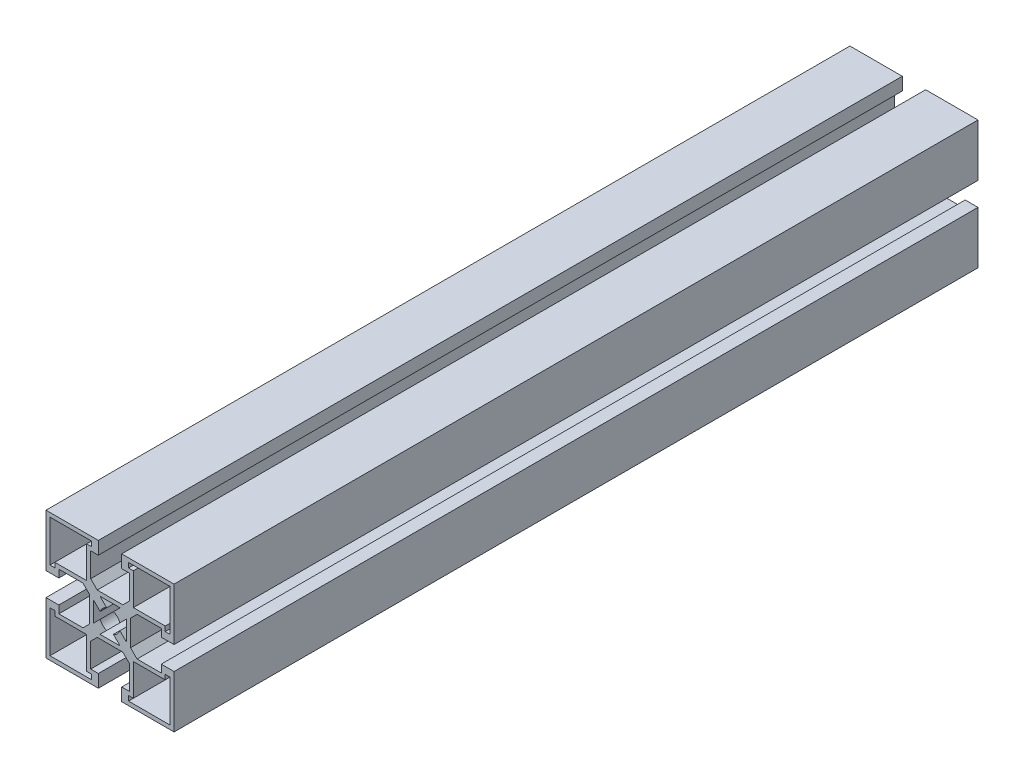
from build123d import *

# Parameters (mm, degrees)
BOSS_EXTRUDE1_DEPTH = 282.5


with BuildPart() as part:
    # Sketch1 → Boss-Extrude1 (new body)
    with BuildSketch(Plane.XY):
        Polygon((-22.499997904, -22.500007621), (-4.099997904, -22.500007621), (-4.099997904, -18.000007621), (-6.799997904, -18.000007621), (-6.799997904, -9.500007621), (-4.499997904, -7.200007621), (4.500002096, -7.200007621), (6.800002096, -9.500007621), (6.800002096, -18.000007621), (4.100002096, -18.000007621), (4.100002096, -22.500007621), (22.500002096, -22.500007621), (22.500002096, -4.100007621), (18.000002096, -4.100007621), (18.000002096, -6.800007621), (9.500002096, -6.800007621), (7.200002096, -4.500007621), (7.200002096, 4.499992379), (9.500002096, 6.799992379), (18.000002096, 6.799992379), (18.000002096, 4.099992379), (22.500002096, 4.099992379), (22.500002096, 22.499992379), (4.100002096, 22.499992379), (4.100002096, 17.999992379), (6.800002096, 17.999992379), (6.800002096, 9.499992379), (4.500002096, 7.199992379), (-4.499997904, 7.199992379), (-6.799997904, 9.499992379), (-6.799997904, 17.999992379), (-4.099997904, 17.999992379), (-4.099997904, 22.499992379), (-22.499997904, 22.499992379), (-22.499997904, 4.099992379), (-17.999997904, 4.099992379), (-17.999997904, 6.799992379), (-9.499997904, 6.799992379), (-7.199997904, 4.499992379), (-7.199997904, -4.500007621), (-9.499997904, -6.800007621), (-17.999997904, -6.800007621), (-17.999997904, -4.100007621), (-22.499997904, -4.100007621), align=None)
        Polygon((8.200003223, 8.199980186), (8.199989777, 19.399992368), (6.500002085, 19.399992368), (6.500002085, 21.099984758), (21.100004192, 21.099984758), (21.100004192, 6.499980188), (19.400009891, 6.499980188), (19.400009891, 8.199980186), align=None, mode=Mode.SUBTRACT)
        Polygon((-19.399997893, 6.499992368), (-21.099990283, 6.499992368), (-21.099990283, 21.099994475), (-6.499974376, 21.099994475), (-6.49997587, 19.399985233), (-8.199975868, 19.399986727), (-8.199985712, 8.19998006), (-19.399997893, 8.19998006), align=None, mode=Mode.SUBTRACT)
        Polygon((-6.499997893, -21.1), (-21.1, -21.1), (-21.1, -6.499995431), (-19.400002096, -6.499995431), (-19.400002096, -8.199995429), (-8.199995429, -8.199995429), (-8.199995429, -19.40000761), (-6.499997893, -19.400009104), align=None, mode=Mode.SUBTRACT)
        Polygon((6.499989905, -19.400011813), (8.199989903, -19.400011813), (8.199989903, -8.200005146), (19.400002085, -8.200005146), (19.400003579, -6.500017454), (21.099994475, -6.500018948), (21.099994475, -21.100009717), (6.499989905, -21.100009717), align=None, mode=Mode.SUBTRACT)
        with BuildLine():
            Line((-5.799999723, 3.537265469), (-3.451121085, 1.18838683))
            ThreePointArc((-3.451121085, 1.18838683), (-2.580942431, 2.580937072), (-1.188393996, 3.451118617))
            Line((-1.188393996, 3.451118617), (-3.537277512, 5.799992379))
            Line((-3.537277512, 5.799992379), (3.537277512, 5.799992379))
            Line((3.537277512, 5.799992379), (1.188393996, 3.451118617))
            ThreePointArc((1.188393996, 3.451118617), (2.580942431, 2.580937072), (3.451121085, 1.18838683))
            Line((3.451121085, 1.18838683), (5.799999723, 3.537265469))
            Line((5.799999723, 3.537265469), (5.799985034, -3.537266022))
            Line((5.799985034, -3.537266022), (3.451117181, -1.188398168))
            ThreePointArc((3.451117181, -1.188398168), (2.580938191, -2.580941312), (1.188393996, -3.451118617))
            Line((1.188393996, -3.451118617), (3.537277512, -5.799992379))
            Line((3.537277512, -5.799992379), (-3.537277512, -5.799992379))
            Line((-3.537277512, -5.799992379), (-1.188393996, -3.451118617))
            ThreePointArc((-1.188393996, -3.451118617), (-2.580938191, -2.580941311), (-3.451117181, -1.188398168))
            Line((-3.451117181, -1.188398168), (-5.799985034, -3.537266022))
            Line((-5.799985034, -3.537266022), (-5.799999723, 3.537265469))
        make_face(mode=Mode.SUBTRACT)
    extrude(amount=BOSS_EXTRUDE1_DEPTH)


solid = part.part
